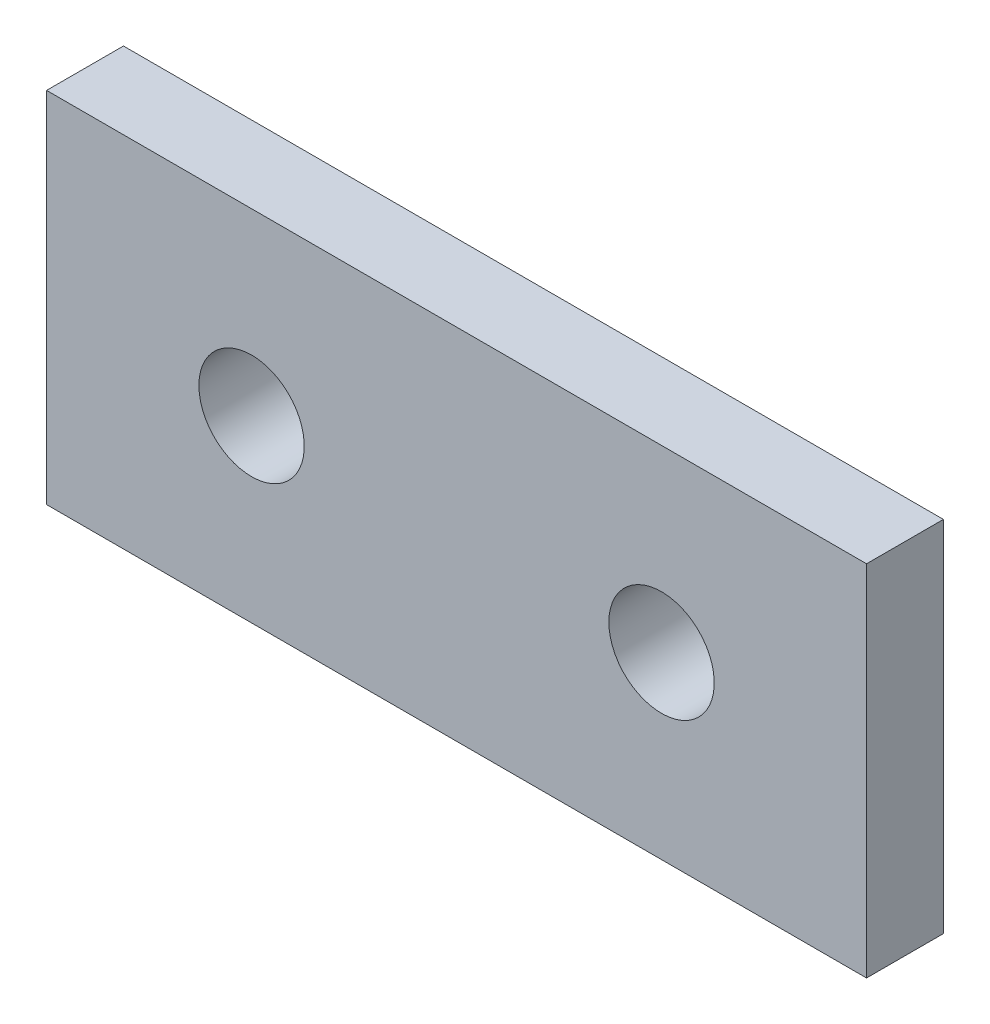
from build123d import *

# Parameters (mm, degrees)
SKETCH1_W           = 50.8
SKETCH1_H           = 22.225
SKETCH1_R           = 3.2639
BOSS_EXTRUDE1_DEPTH = 2.38125


with BuildPart() as part:
    # Sketch1 → Boss-Extrude1 (new, symmetric)
    with BuildSketch(Plane.XY):
        with Locations((25.4, 11.1125)):
            Rectangle(SKETCH1_W, SKETCH1_H)
        with Locations(Location((12.7, 11.1125, 0), (0, 0, 180))):
            Circle(SKETCH1_R, mode=Mode.SUBTRACT)
        with Locations(Location((38.1, 11.1125, 0), (0, 0, 180))):
            Circle(SKETCH1_R, mode=Mode.SUBTRACT)
    extrude(amount=BOSS_EXTRUDE1_DEPTH, both=True)


solid = part.part
